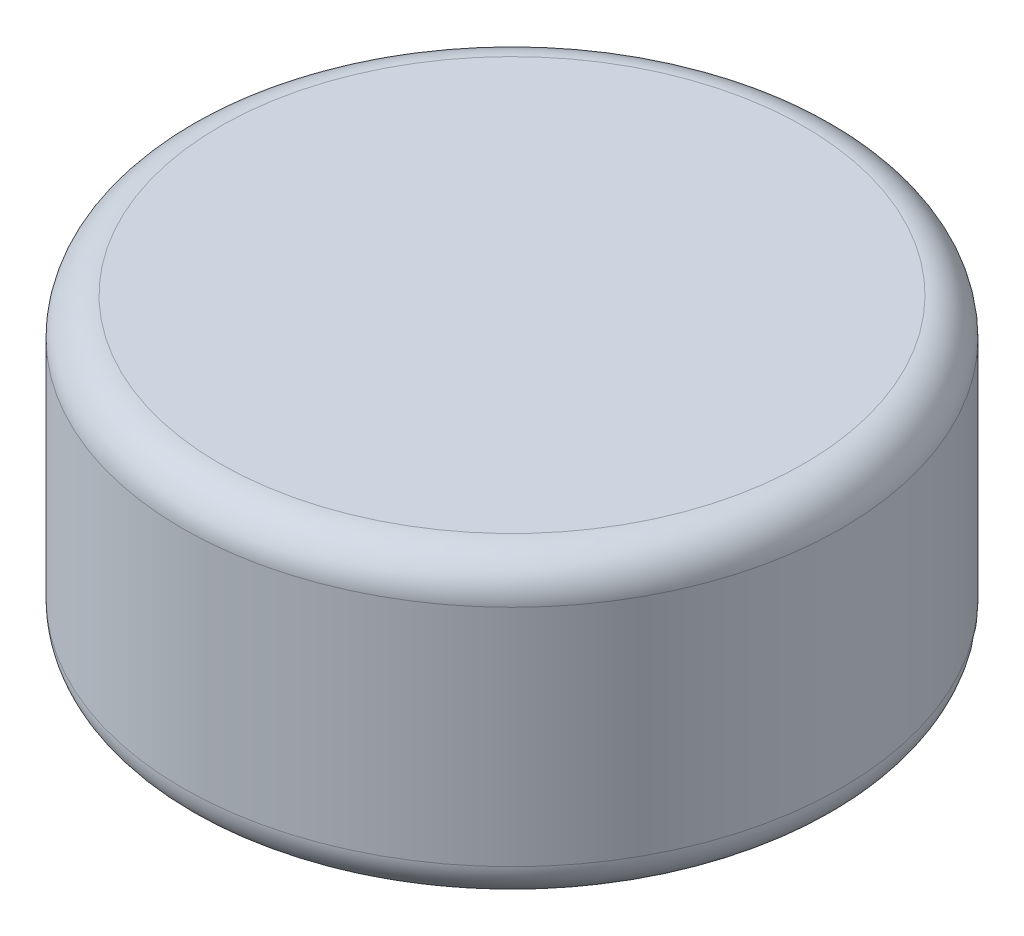
from build123d import *

# Parameters (mm, degrees)
SKETCH1_R           = 55.88
BOSS_EXTRUDE1_DEPTH = 50.8
FILLET1_R           = 6.35


with BuildPart() as part:
    # Sketch1 → Boss-Extrude1 (new body)
    with BuildSketch(Plane(origin=(0, 0, 0), x_dir=(1, 0, 0), z_dir=(0, 1, 0))):
        with Locations(Location((0, 0, 0), (0, 0, 270))):
            Circle(SKETCH1_R)
    extrude(amount=-BOSS_EXTRUDE1_DEPTH)

    # Fillet1
    fillet1_edges = [part.edges().sort_by_distance(p)[0] for p in [
        (0, 0, -55.88),
        (0, -50.8, -55.88),
    ]]
    fillet(fillet1_edges, radius=FILLET1_R)


solid = part.part
